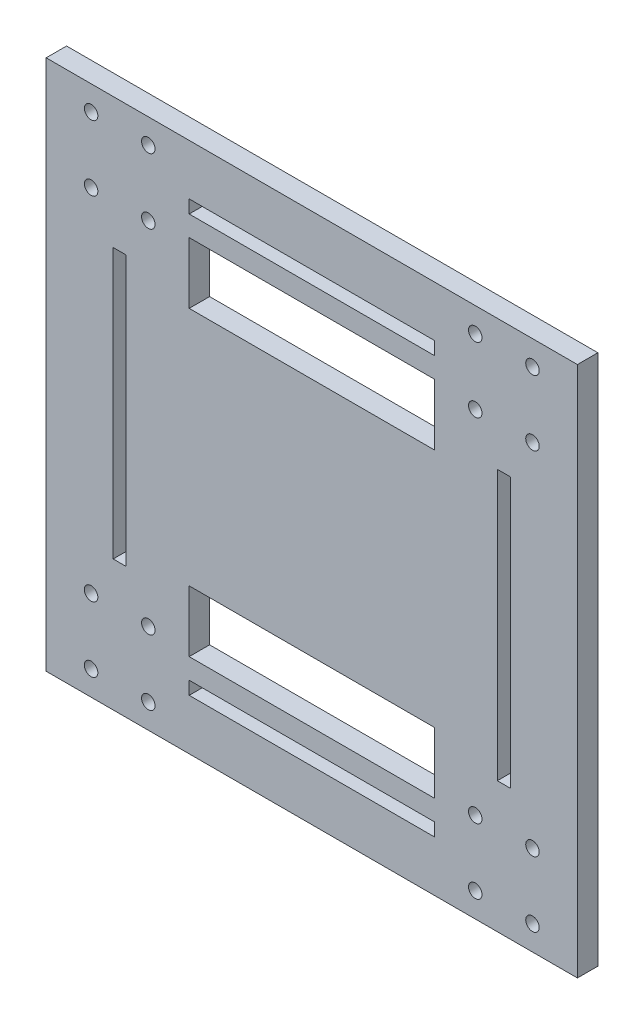
from build123d import *

# Parameters (mm, degrees)
SKETCH_1_W          = 130
SKETCH_1_H          = 130
EXTRUDE_1_DEPTH     = 5
SKETCH_2_R          = 1.65
CUT_EXTRUDE_1_DEPTH = 5
SKETCH_3_W          = 3.2
SKETCH_3_H          = 66
SKETCH_3_W_2        = 60
SKETCH_3_H_2        = 3.2
CUT_EXTRUDE_2_DEPTH = 10
SKETCH_4_W          = 60
SKETCH_4_H          = 15
CUT_EXTRUDE_3_DEPTH = 10


with BuildPart() as part:
    # 草图1 → 凸台-拉伸1 (new body)
    with BuildSketch(Plane.XY):
        Rectangle(SKETCH_1_W, SKETCH_1_H)
    extrude(amount=EXTRUDE_1_DEPTH)

    # 草图2 → 切除-拉伸1 (cut)
    with BuildSketch(Plane.XY.offset(5)):
        with Locations((-54, 59)):
            Circle(SKETCH_2_R)
        with Locations((-40, 59)):
            Circle(SKETCH_2_R)
        with Locations((-40, 43)):
            Circle(SKETCH_2_R)
        with Locations((-54, 43)):
            Circle(SKETCH_2_R)
        with Locations((40, 59)):
            Circle(SKETCH_2_R)
        with Locations((54, 59)):
            Circle(SKETCH_2_R)
        with Locations((54, 43)):
            Circle(SKETCH_2_R)
        with Locations((40, 43)):
            Circle(SKETCH_2_R)
        with Locations((40, -43)):
            Circle(SKETCH_2_R)
        with Locations((54, -43)):
            Circle(SKETCH_2_R)
        with Locations((54, -59)):
            Circle(SKETCH_2_R)
        with Locations((40, -59)):
            Circle(SKETCH_2_R)
        with Locations((-54, -43)):
            Circle(SKETCH_2_R)
        with Locations((-40, -43)):
            Circle(SKETCH_2_R)
        with Locations((-40, -59)):
            Circle(SKETCH_2_R)
        with Locations((-54, -59)):
            Circle(SKETCH_2_R)
    extrude(amount=-CUT_EXTRUDE_1_DEPTH, mode=Mode.SUBTRACT)

    # 草图3 → 切除-拉伸2 (cut)
    with BuildSketch(Plane.XY.offset(5)):
        with Locations((47, 0)):
            Rectangle(SKETCH_3_W, SKETCH_3_H)
        with Locations((-47, 0)):
            Rectangle(SKETCH_3_W, SKETCH_3_H)
        with Locations((0, -51)):
            Rectangle(SKETCH_3_W_2, SKETCH_3_H_2)
        with Locations((0, 51)):
            Rectangle(SKETCH_3_W_2, SKETCH_3_H_2)
    extrude(amount=-CUT_EXTRUDE_2_DEPTH, mode=Mode.SUBTRACT)

    # 草图4 → 切除-拉伸3 (cut)
    with BuildSketch(Plane(origin=(0, 0, 0), x_dir=(-1, 0, 0), z_dir=(0, 0, -1))):
        with Locations((0, 36.9)):
            Rectangle(SKETCH_4_W, SKETCH_4_H)
        with Locations((0, -36.9)):
            Rectangle(SKETCH_4_W, SKETCH_4_H)
    extrude(amount=-CUT_EXTRUDE_3_DEPTH, mode=Mode.SUBTRACT)


solid = part.part
